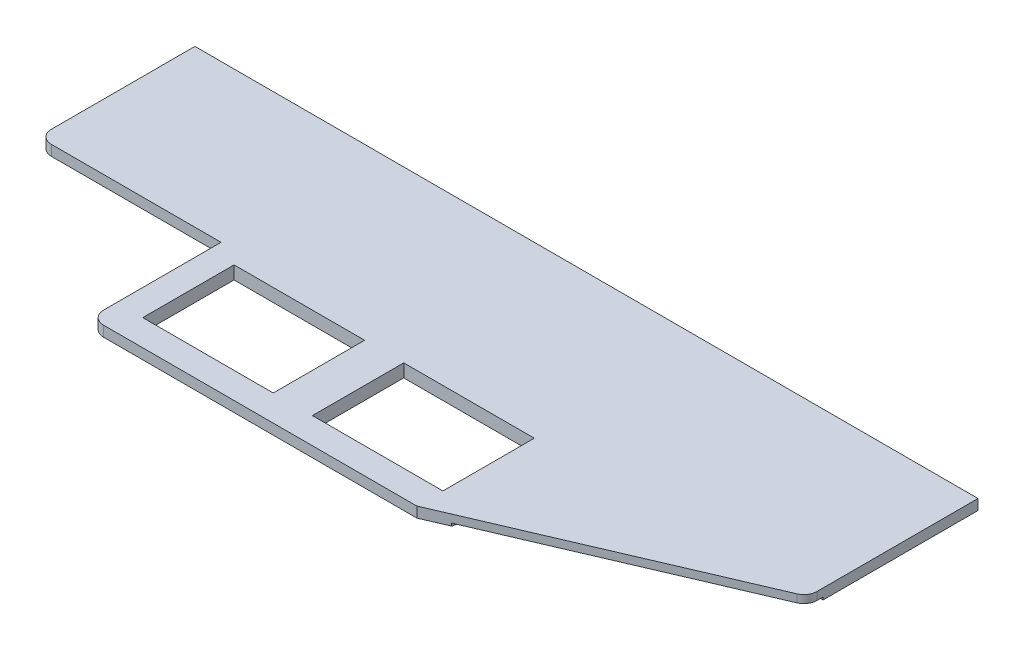
from build123d import *

# Parameters (mm, degrees)
SKETCH1_W           = 381
SKETCH1_H           = 6.35
BOSS_EXTRUDE1_DEPTH = 139.7
CUT_EXTRUDE1_DEPTH  = 406.853930004
SKETCH3_W           = 63.5
SKETCH3_H           = 44.45
CUT_EXTRUDE2_DEPTH  = 406.853930004
CUT_EXTRUDE3_DEPTH  = 1.27
CUT_EXTRUDE4_DEPTH  = 1.27
CUT_EXTRUDE5_DEPTH  = 1.27
SKETCH7_RX          = 10.638157658
SKETCH7_RY          = 7.265083279
BOSS_EXTRUDE2_DEPTH = 1.27
CUT_EXTRUDE6_DEPTH  = 2.54
SKETCH9_R           = 7.62
BOSS_EXTRUDE3_DEPTH = 1.27
SKETCH10_R          = 5.08
CUT_EXTRUDE7_DEPTH  = 2.54
CUT_EXTRUDE10_DEPTH = 1.27
SKETCH14_R          = 5.08
SKETCH14_W          = 11.43
SKETCH14_H          = 6.35
BOSS_EXTRUDE4_DEPTH = 1.27


with BuildPart() as part:
    # Sketch1 → Boss-Extrude1 (new body)
    with BuildSketch(Plane.XY):
        with Locations((-190.5, 3.175)):
            Rectangle(SKETCH1_W, SKETCH1_H)
    extrude(amount=BOSS_EXTRUDE1_DEPTH)

    # Sketch2 → Cut-Extrude1 (cut, through all)
    with BuildSketch(Plane.XZ):
        with BuildLine():
            ThreePointArc((-381, 69.85), (-379.140128061, 74.340128061), (-374.65, 76.2))
            Line((-374.65, 76.2), (-292.1, 76.2))
            Line((-292.1, 76.2), (-292.1, 133.35))
            ThreePointArc((-292.1, 133.35), (-290.240128061, 137.840128061), (-285.75, 139.7))
            Line((-285.75, 139.7), (-381, 139.7))
            Line((-381, 139.7), (-381, 69.85))
        make_face()
        with BuildLine():
            Line((0, 139.7), (-133.35, 139.7))
            Line((-133.35, 139.7), (-3.848612454, 84.199405337))
            ThreePointArc((-3.848612454, 84.199405337), (-1.048759064, 81.858452302), (0, 78.362834397))
            Line((0, 78.362834397), (0, 139.7))
        make_face()
    extrude(amount=-CUT_EXTRUDE1_DEPTH, mode=Mode.SUBTRACT)

    # Sketch3 → Cut-Extrude2 (cut, through all)
    with BuildSketch(Plane(origin=(0, 6.35, 0), x_dir=(1, 0, 0), z_dir=(0, 1, 0))):
        with Locations((-165.1, -104.775)):
            Rectangle(SKETCH3_W, SKETCH3_H)
        with Locations((-247.65, -104.775)):
            Rectangle(SKETCH3_W, SKETCH3_H)
    extrude(amount=-CUT_EXTRUDE2_DEPTH, mode=Mode.SUBTRACT)

    # Sketch4 → Cut-Extrude3 (cut)
    with BuildSketch(Plane.XZ):
        with BuildLine():
            Line((-3.848612454, 84.199405337), (-133.35, 139.7))
            Line((-133.35, 139.7), (-285.75, 139.7))
            ThreePointArc((-285.75, 139.7), (-290.240128061, 137.840128061), (-292.1, 133.35))
            Line((-292.1, 133.35), (-292.1, 76.2))
            Line((-292.1, 76.2), (-374.65, 76.2))
            ThreePointArc((-374.65, 76.2), (-379.140128061, 74.340128061), (-381, 69.85))
            Line((-381, 69.85), (-381, 0))
            Line((-381, 0), (0, 0))
            Line((0, 0), (0, 78.362834397))
            ThreePointArc((0, 78.362834397), (-1.048759064, 81.858452302), (-3.848612454, 84.199405337))
        make_face()
        with BuildLine():
            ThreePointArc((-285.75, 127), (-283.890128061, 131.490128061), (-279.4, 133.35))
            Line((-279.4, 133.35), (-215.9, 133.35))
            ThreePointArc((-215.9, 133.35), (-211.409871939, 131.490128061), (-209.55, 127))
            Line((-209.55, 127), (-209.55, 25.4))
            ThreePointArc((-209.55, 25.4), (-211.409871939, 20.909871939), (-215.9, 19.05))
            Line((-215.9, 19.05), (-279.4, 19.05))
            ThreePointArc((-279.4, 19.05), (-283.890128061, 20.909871939), (-285.75, 25.4))
            Line((-285.75, 25.4), (-285.75, 127))
        make_face(mode=Mode.SUBTRACT)
        with BuildLine():
            Line((-196.85, 133.35), (-127, 133.35))
            Line((-127, 133.35), (-112.137573981, 74.878893992))
            Line((-112.137573981, 74.878893992), (-125.744419224, 23.76643633))
            ThreePointArc((-125.744419224, 23.76643633), (-128.010988421, 20.365338676), (-131.88070228, 19.05))
            Line((-131.88070228, 19.05), (-196.85, 19.05))
            ThreePointArc((-196.85, 19.05), (-201.340128061, 20.909871939), (-203.2, 25.4))
            Line((-203.2, 25.4), (-203.2, 127))
            ThreePointArc((-203.2, 127), (-201.340128061, 131.490128061), (-196.85, 133.35))
        make_face(mode=Mode.SUBTRACT)
    extrude(amount=-CUT_EXTRUDE3_DEPTH, mode=Mode.SUBTRACT)

    # Sketch5 → Cut-Extrude4 (cut)
    with BuildSketch(Plane.XZ):
        with BuildLine():
            ThreePointArc((-158.992065813, 53.903274114), (-161.23709196, 53.287195771), (-163.421462968, 54.092315777))
            Line((-163.421462968, 54.092315777), (-185.887975323, 71.659056802))
            ThreePointArc((-185.887975323, 71.659056802), (-186.724879694, 74.487406876), (-184.323422249, 76.2))
            Line((-184.323422249, 76.2), (-133.639840253, 76.2))
            Line((-133.639840253, 76.2), (-133.371973018, 76.2))
            ThreePointArc((-133.371973018, 76.2), (-130.937419027, 74.384256076), (-131.983594655, 71.533029027))
            Line((-131.983594655, 71.533029027), (-158.992065813, 53.903274114))
        make_face()
        with BuildLine():
            ThreePointArc((-134.022318328, 31.104895564), (-131.650325923, 30.697594229), (-130.003252032, 32.452413293))
            Line((-130.003252032, 32.452413293), (-121.14221986, 65.737801909))
            ThreePointArc((-121.14221986, 65.737801909), (-122.107836854, 68.449087436), (-124.985111445, 68.51819835))
            Line((-124.985111445, 68.51819835), (-151.528786111, 51.191838923))
            ThreePointArc((-151.528786111, 51.191838923), (-153.252753369, 48.163841066), (-151.793048177, 44.999967667))
            Line((-151.793048177, 44.999967667), (-134.022318328, 31.104895564))
        make_face()
        with BuildLine():
            ThreePointArc((-144.407280031, 25.4), (-142.005822585, 27.112593124), (-142.842726957, 29.940943198))
            Line((-142.842726957, 29.940943198), (-159.460209971, 42.934282617))
            ThreePointArc((-159.460209971, 42.934282617), (-161.644580979, 43.739402623), (-163.889607126, 43.123324281))
            Line((-163.889607126, 43.123324281), (-183.891708315, 30.066970973))
            ThreePointArc((-183.891708315, 30.066970973), (-184.937883944, 27.215743924), (-182.503329952, 25.4))
            Line((-182.503329952, 25.4), (-144.407280031, 25.4))
        make_face()
        with BuildLine():
            Line((-196.85, 66.959325487), (-196.85, 33.882758471))
            ThreePointArc((-196.85, 33.882758471), (-195.519363254, 31.649142452), (-192.921621637, 31.755787497))
            Line((-192.921621637, 31.755787497), (-171.352886828, 45.834759471))
            ThreePointArc((-171.352886828, 45.834759471), (-169.62891957, 48.862757328), (-171.088624762, 52.026630727))
            Line((-171.088624762, 52.026630727), (-192.745446926, 68.960268685))
            ThreePointArc((-192.745446926, 68.960268685), (-195.423021831, 69.242477345), (-196.85, 66.959325487))
        make_face()
        with BuildLine():
            Line((-215.9, 34.229440484), (-215.9, 67.737366324))
            ThreePointArc((-215.9, 67.737366324), (-217.342192636, 70.027872598), (-220.031038577, 69.71731487))
            Line((-220.031038577, 69.71731487), (-239.692082997, 53.918176966))
            ThreePointArc((-239.692082997, 53.918176966), (-241.115522876, 50.944107883), (-239.685613264, 47.973143982))
            Line((-239.685613264, 47.973143982), (-220.026725421, 32.246033708))
            ThreePointArc((-220.026725421, 32.246033708), (-217.339700625, 31.940130264), (-215.9, 34.229440484))
        make_face()
        with BuildLine():
            ThreePointArc((-227.288401483, 29.923406776), (-226.478310973, 27.099242369), (-228.875126903, 25.4))
            Line((-228.875126903, 25.4), (-267.965347007, 25.4))
            ThreePointArc((-267.965347007, 25.4), (-270.361246557, 27.096634512), (-269.556385584, 29.919948547))
            Line((-269.556385584, 29.919948547), (-250.848605829, 44.953066112))
            ThreePointArc((-250.848605829, 44.953066112), (-248.466194227, 45.793141036), (-246.081959833, 44.958253456))
            Line((-246.081959833, 44.958253456), (-227.288401483, 29.923406776))
        make_face()
        with BuildLine():
            Line((-246.09497637, 56.919138608), (-227.725938458, 71.680051453))
            ThreePointArc((-227.725938458, 71.680051453), (-226.921077485, 74.503365488), (-229.316977035, 76.2))
            Line((-229.316977035, 76.2), (-267.728199395, 76.2))
            ThreePointArc((-267.728199395, 76.2), (-270.125015326, 74.500757631), (-269.314924816, 71.676593224))
            Line((-269.314924816, 71.676593224), (-250.861622366, 56.913951264))
            ThreePointArc((-250.861622366, 56.913951264), (-248.477387972, 56.079063684), (-246.09497637, 56.919138608))
        make_face()
        with BuildLine():
            Line((-279.4, 66.327898477), (-279.4, 35.455581143))
            ThreePointArc((-279.4, 35.455581143), (-277.957807364, 33.165074869), (-275.268961423, 33.475632597))
            Line((-275.268961423, 33.475632597), (-257.251499201, 47.954027754))
            ThreePointArc((-257.251499201, 47.954027754), (-255.828059322, 50.928096837), (-257.257968935, 53.899060738))
            Line((-257.257968935, 53.899060738), (-275.273274579, 68.311305253))
            ThreePointArc((-275.273274579, 68.311305253), (-277.960299375, 68.617208697), (-279.4, 66.327898477))
        make_face()
    extrude(amount=-CUT_EXTRUDE4_DEPTH, mode=Mode.SUBTRACT)

    # Sketch6 → Cut-Extrude5 (cut)
    with BuildSketch(Plane.XZ.offset(-1.27)):
        with BuildLine():
            Line((-248.158, 6.985), (-248.158, 13.335))
            ThreePointArc((-248.158, 13.335), (-251.206, 16.383), (-254.254, 13.335))
            Line((-254.254, 13.335), (-254.254, 6.985))
            ThreePointArc((-254.254, 6.985), (-251.206, 3.937), (-248.158, 6.985))
        make_face()
        with BuildLine():
            Line((-159.512, 6.985), (-159.512, 13.335))
            ThreePointArc((-159.512, 13.335), (-162.56, 16.383), (-165.608, 13.335))
            Line((-165.608, 13.335), (-165.608, 6.985))
            ThreePointArc((-165.608, 6.985), (-162.56, 3.937), (-159.512, 6.985))
        make_face()
        with BuildLine():
            Line((-140.716, 6.985), (-140.716, 13.335))
            ThreePointArc((-140.716, 13.335), (-143.764, 16.383), (-146.812, 13.335))
            Line((-146.812, 13.335), (-146.812, 6.985))
            ThreePointArc((-146.812, 6.985), (-143.764, 3.937), (-140.716, 6.985))
        make_face()
        with BuildLine():
            Line((-121.92, 6.985), (-121.92, 13.335))
            ThreePointArc((-121.92, 13.335), (-124.968, 16.383), (-128.016, 13.335))
            Line((-128.016, 13.335), (-128.016, 6.985))
            ThreePointArc((-128.016, 6.985), (-124.968, 3.937), (-121.92, 6.985))
        make_face()
        with BuildLine():
            Line((-266.954, 6.985), (-266.954, 13.335))
            ThreePointArc((-266.954, 13.335), (-270.002, 16.383), (-273.05, 13.335))
            Line((-273.05, 13.335), (-273.05, 6.985))
            ThreePointArc((-273.05, 6.985), (-270.002, 3.937), (-266.954, 6.985))
        make_face()
        with BuildLine():
            Line((-285.75, 6.985), (-285.75, 13.335))
            ThreePointArc((-285.75, 13.335), (-288.798, 16.383), (-291.846, 13.335))
            Line((-291.846, 13.335), (-291.846, 6.985))
            ThreePointArc((-291.846, 6.985), (-288.798, 3.937), (-285.75, 6.985))
        make_face()
    extrude(amount=-CUT_EXTRUDE5_DEPTH, mode=Mode.SUBTRACT)

    # Sketch7 → Boss-Extrude2 (add)
    with BuildSketch(Plane.XZ.offset(-1.27)):
        with Locations(Location((-102.329210388, 61.253935302), (0, 0, 90))):
            Ellipse(SKETCH7_RX, SKETCH7_RY)
    extrude(amount=BOSS_EXTRUDE2_DEPTH)

    # Sketch8 → Cut-Extrude6 (cut)
    with BuildSketch(Plane.XZ):
        with BuildLine():
            add(Edge.make_bspline(
                [(-102.329210388, 53.155777643), (-102.112758869, 53.155777643), (-101.90165855, 53.184733869), (-101.488693819, 53.29262333), (-101.285989099, 53.372491654), (-100.906134378, 53.565827315), (-100.726271614, 53.679807762), (-100.382645705, 53.935462419), (-100.219893263, 54.076719563), (-99.764069992, 54.523015248), (-99.497769004, 54.853884591), (-99.020239481, 55.564478945), (-98.814571853, 55.936822891), (-98.456537688, 56.702496854), (-98.303821873, 57.096880827), (-98.043897216, 57.905627606), (-97.93694989, 58.320684281), (-97.685170772, 59.564921728), (-97.604474239, 60.402865358), (-97.603955181, 61.671468822), (-97.624537227, 62.098727862), (-97.707574037, 62.943449926), (-97.769697493, 63.360708886), (-98.019835892, 64.596695994), (-98.268534926, 65.400397992), (-98.81064993, 66.564087993), (-99.016899152, 66.93745653), (-99.490891269, 67.644695452), (-99.76140618, 67.981745124), (-100.216477408, 68.428053725), (-100.376714264, 68.567454964), (-100.718552192, 68.82283879), (-100.901455485, 68.939296763), (-101.281621707, 69.133512578), (-101.480360605, 69.212535587), (-101.897705612, 69.322623081), (-102.108175779, 69.351318098), (-102.532927978, 69.352836862), (-102.749721759, 69.324409496), (-103.163652722, 69.217383132), (-103.364910451, 69.138724573), (-103.747979792, 68.944703036), (-103.92786111, 68.8308471), (-104.269743776, 68.577289353), (-104.432452105, 68.436717912), (-104.892344941, 67.987565013), (-105.158068026, 67.657051526), (-105.632472982, 66.952651746), (-105.84141111, 66.575855339), (-106.381043429, 65.423036607), (-106.633833171, 64.616915287), (-106.88839125, 63.363953584), (-106.950841871, 62.942910835), (-107.033547657, 62.102731031), (-107.054050785, 61.682251454), (-107.054532282, 60.840534907), (-107.034513011, 60.419297982), (-106.952348017, 59.576036803), (-106.889682762, 59.152120735), (-106.637395321, 57.904861607), (-106.38643813, 57.098809521), (-105.845816734, 55.940225585), (-105.638318792, 55.565088352), (-105.283208535, 55.036057222), (-105.157215657, 54.864800233), (-104.887261102, 54.534276909), (-104.742776803, 54.374616224), (-104.438331426, 54.076520809), (-104.277847031, 53.937256286), (-103.936531746, 53.682820747), (-103.753864897, 53.566720171), (-103.373085917, 53.372735724), (-103.175006788, 53.294335437), (-102.759198786, 53.185043833), (-102.545661908, 53.155777643), (-102.329210388, 53.155777643)],
                knots=[0, 0, 0, 0, 0.015625, 0.015625, 0.03125, 0.03125, 0.046875, 0.046875, 0.0625, 0.0625, 0.09375, 0.09375, 0.125, 0.125, 0.15625, 0.15625, 0.1875, 0.1875, 0.25, 0.25, 0.28125, 0.28125, 0.3125, 0.3125, 0.375, 0.375, 0.40625, 0.40625, 0.4375, 0.4375, 0.453125, 0.453125, 0.46875, 0.46875, 0.484375, 0.484375, 0.5, 0.5, 0.515625, 0.515625, 0.53125, 0.53125, 0.546875, 0.546875, 0.5625, 0.5625, 0.59375, 0.59375, 0.625, 0.625, 0.6875, 0.6875, 0.71875, 0.71875, 0.75, 0.75, 0.78125, 0.78125, 0.8125, 0.8125, 0.875, 0.875, 0.90625, 0.90625, 0.921875, 0.921875, 0.9375, 0.9375, 0.953125, 0.953125, 0.96875, 0.96875, 0.984375, 0.984375, 1, 1, 1, 1], degree=3))
        make_face()
    extrude(amount=-CUT_EXTRUDE6_DEPTH, mode=Mode.SUBTRACT)

    # Sketch9 → Boss-Extrude3 (add)
    with BuildSketch(Plane.XZ.offset(-1.27)):
        with Locations(Location((-20.387686115, 60.831492086, 0), (0, 0, 270))):
            Circle(SKETCH9_R)
    extrude(amount=BOSS_EXTRUDE3_DEPTH)

    # Sketch10 → Cut-Extrude7 (cut)
    with BuildSketch(Plane.XZ):
        with Locations(Location((-20.387686115, 60.831492086, 0), (0, 0, 270))):
            Circle(SKETCH10_R)
    extrude(amount=-CUT_EXTRUDE7_DEPTH, mode=Mode.SUBTRACT)

    # Sketch13 → Cut-Extrude10 (cut)
    with BuildSketch(Plane.XZ.offset(-1.27)):
        with BuildLine():
            Line((0, 75.388570939), (0, 78.362834397))
            ThreePointArc((0, 78.362834397), (-1.048759064, 81.858452302), (-3.848612454, 84.199405337))
            Line((-3.848612454, 84.199405337), (-121.475018203, 134.610722087))
            Line((-121.475018203, 134.610722087), (-119.147762172, 125.454933261))
            Line((-119.147762172, 125.454933261), (-106.421688444, 75.388570939))
            Line((-106.421688444, 75.388570939), (0, 75.388570939))
        make_face()
    extrude(amount=-CUT_EXTRUDE10_DEPTH, mode=Mode.SUBTRACT)

    # Sketch14 → Boss-Extrude4 (add)
    with BuildSketch(Plane.XZ.offset(-1.27)):
        with Locations(Location((-370.84, 62.855298511, 0), (0, 0, 270))):
            Circle(SKETCH14_R)
        with Locations((-349.885, 69.692429512)):
            Rectangle(SKETCH14_W, SKETCH14_H)
    extrude(amount=BOSS_EXTRUDE4_DEPTH)


solid = part.part
